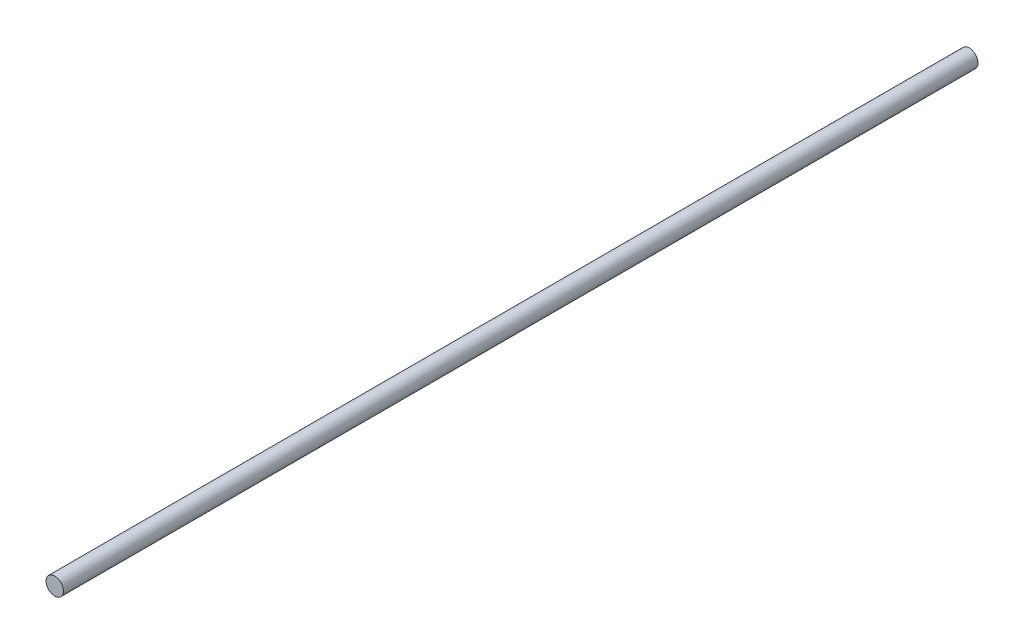
from build123d import *

# Parameters (mm, degrees)
SKETCH1_R           = 7.9375
BOSS_EXTRUDE1_DEPTH = 831.85


with BuildPart() as part:
    # Sketch1 → Boss-Extrude1 (new body)
    with BuildSketch(Plane.XY):
        with Locations(Location((0, 0, 0), (0, 0, 180))):
            Circle(SKETCH1_R)
    extrude(amount=BOSS_EXTRUDE1_DEPTH)


solid = part.part
